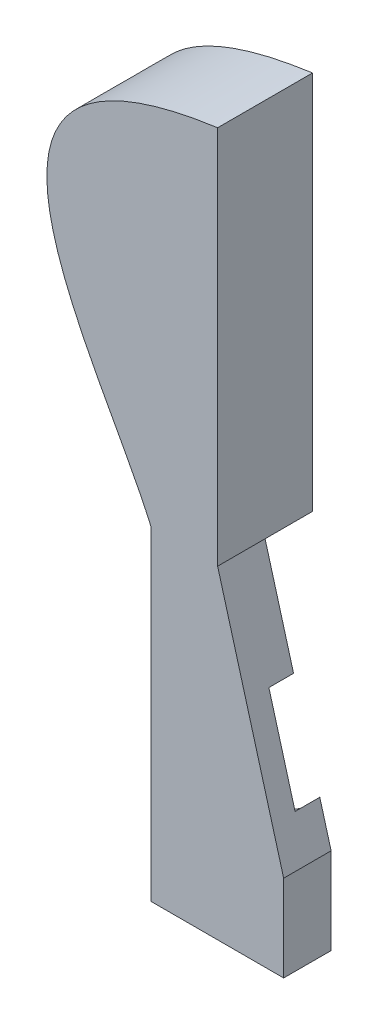
from build123d import *

# Parameters (mm, degrees)
BOSS_EXTRUDE1_DEPTH = 50
SKETCH3_W           = 66.376369139
SKETCH3_H           = 188.96079622
CUT_EXTRUDE1_DEPTH  = 305.408240944
SKETCH4_R           = 34.5
CUT_EXTRUDE2_DEPTH  = 13


with BuildPart() as part:
    # Sketch1 → Boss-Extrude1 (new body)
    with BuildSketch(Plane.XY):
        with BuildLine():
            Line((0.221790001, 84.828286355), (0.2207262, 284.828286352))
            add(Edge.make_bspline(
                [(0.2207262, 284.828286352), (-159.978737061, 262.606607754), (-63.000724603, 150.139017081), (-35, 85.625)],
                knots=[0, 0, 0, 0, 1, 1, 1, 1], degree=3))
            Line((-35, 85.625), (-35, -85.625))
            Line((-35, -85.625), (35, -85.625))
            Line((35, -85.625), (35, -40.1019375))
            Line((35, -40.1019375), (0.221790001, 84.828286355))
        make_face()
    extrude(amount=BOSS_EXTRUDE1_DEPTH)

    # Sketch3 → Cut-Extrude1 (cut, through all)
    with BuildSketch(Plane(origin=(22.122011617, 6.158349372, 0), x_dir=(0, 0, -1), z_dir=(0.9633678796634119, 0.2681833858254875, 0))):
        with Locations((8.18818457, -12.819032142)):
            Rectangle(SKETCH3_W, SKETCH3_H)
    extrude(amount=-CUT_EXTRUDE1_DEPTH, mode=Mode.SUBTRACT)

    # Sketch4 → Cut-Extrude2 (cut)
    with BuildSketch(Plane(origin=(0, 0, 25), x_dir=(-1, 0, 0), z_dir=(0, 0, -1))):
        Circle(SKETCH4_R)
    extrude(amount=-CUT_EXTRUDE2_DEPTH, mode=Mode.SUBTRACT)


solid = part.part
